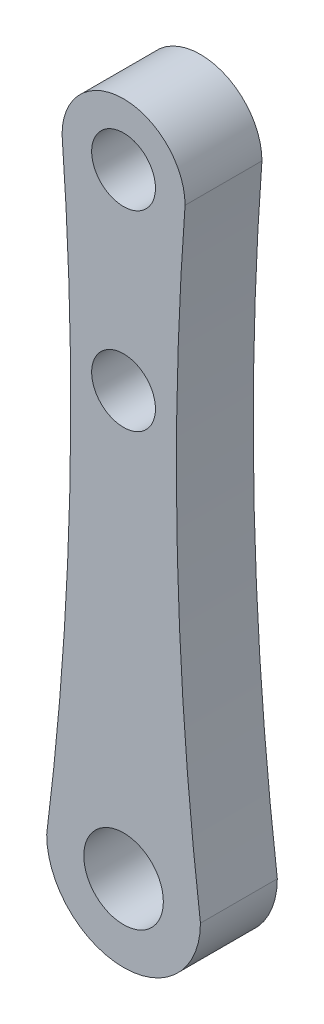
from build123d import *

# Parameters (mm, degrees)
ESBO_O1_R                = 4.15
ESBO_O1_R_2              = 5.175
RESSALTO_EXTRUS_O1_DEPTH = 5


with BuildPart() as part:
    # Esboço1 → Ressalto-extrusão1 (new, symmetric)
    with BuildSketch(Plane.XY):
        with BuildLine():
            ThreePointArc((198.88140452, 100), (208.88140452, 90), (218.88140452, 100))
            ThreePointArc((218.88140452, 100), (215.88140452, 139.886857429), (216.88140452, 179.873872767))
            ThreePointArc((216.88140452, 179.873872767), (208.88140452, 187.873872767), (200.88140452, 179.873872767))
            ThreePointArc((200.88140452, 179.873872767), (201.88140452, 139.886857429), (198.88140452, 100))
        make_face()
        with Locations((208.88140452, 155)):
            Circle(ESBO_O1_R, mode=Mode.SUBTRACT)
        with Locations((208.88140452, 179.873872767)):
            Circle(ESBO_O1_R, mode=Mode.SUBTRACT)
        with Locations((208.88140452, 100)):
            Circle(ESBO_O1_R_2, mode=Mode.SUBTRACT)
    extrude(amount=RESSALTO_EXTRUS_O1_DEPTH, both=True)


solid = part.part
